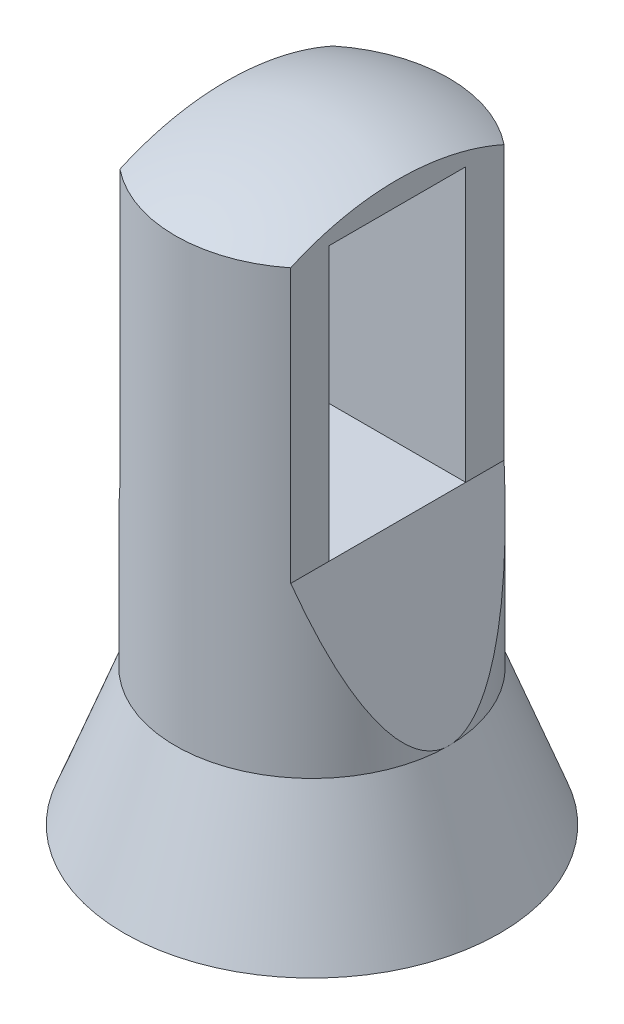
from build123d import *

# Parameters (mm, degrees)
CUT_EXTRUDE2_DEPTH      = 125.51506435
CUT_EXTRUDE2_DEPTH_BACK = 125.51506435
SKETCH7_W               = 25.4
SKETCH7_H               = 50.8
CUT_EXTRUDE3_DEPTH      = 254


with BuildPart() as part:
    # Sketch1 → Revolve1 (revolve)
    with BuildSketch(Plane.XY, mode=Mode.PRIVATE) as revolve1_sk:
        with BuildLine():
            Line((0, 0), (34.925, 0))
            Line((34.925, 0), (25.4, 25.4))
            Line((25.4, 25.4), (25.4, 107.494090512))
            ThreePointArc((25.4, 107.494090512), (13.148007491, 112.569031975), (0, 114.3))
            Line((0, 114.3), (0, 0))
        make_face()
    revolve(revolve1_sk.sketch.rotate(Axis((0, 114.3, 0), (0, -1, 0)), 90), axis=Axis((0, 114.3, 0), (0, -1, 0)))

    # Sketch6 → Cut-Extrude2 (cut, two sides: drawn at the far end of the back side and taken through both)
    with BuildSketch(Plane.XY.offset(-CUT_EXTRUDE2_DEPTH_BACK)):
        Polygon((-15.875, 56.694090512), (-25.4, 25.4), (-28.70874161, 28.70874161), (-29.778723272, 127.895690519), (-15.875, 127.895690519), align=None)
        Polygon((15.875, 127.895690519), (29.778723272, 127.895690519), (28.70874161, 28.70874161), (25.4, 25.4), (15.875, 56.694090512), align=None)
    extrude(amount=CUT_EXTRUDE2_DEPTH + CUT_EXTRUDE2_DEPTH_BACK, mode=Mode.SUBTRACT)

    # Sketch7 → Cut-Extrude3 (cut)
    with BuildSketch(Plane(origin=(15.875, 0, 0), x_dir=(0, 0, -1), z_dir=(1, 0, 0))):
        with Locations((0, 82.094090512)):
            Rectangle(SKETCH7_W, SKETCH7_H)
    extrude(amount=-CUT_EXTRUDE3_DEPTH, mode=Mode.SUBTRACT)


solid = part.part
